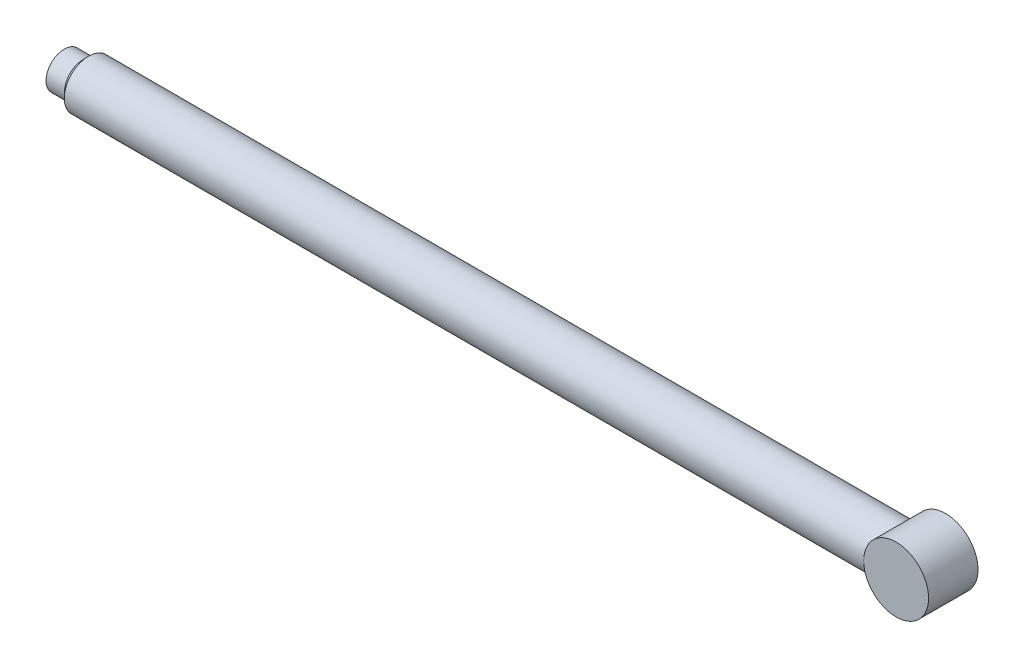
from build123d import *

# Parameters (mm, degrees)
SKETCH2_R                 = 150
SKETCH2_R_2               = 62.5
BOSS_EXTRUDE1_DEPTH       = 5000
SKETCH3_R                 = 112.5
SKETCH3_R_2               = 92.5
BOSS_EXTRUDE2_DEPTH       = 150
BOSS_EXTRUDE9_START       = -150
SKETCH4_R                 = 200
SKETCH4_R_2               = 150
BOSS_EXTRUDE9_DEPTH       = 300
SKETCH5_R                 = 150
CUT_EXTRUDE1_DEPTH        = 175
SKETCH6_R                 = 50
CUT_EXTRUDE2_DEPTH        = 5024
BOSS_EXTRUDE10_DEPTH      = 5
BOSS_EXTRUDE10_DEPTH_BACK = 5
SKETCH9_R                 = 200
SKETCH10_R                = 150
CUT_EXTRUDE3_DEPTH        = 202


with BuildPart() as part:
    # Sketch2 → Boss-Extrude1 (new body)
    with BuildSketch(Plane(origin=(0, 0, 0), x_dir=(0, 0, -1), z_dir=(1, 0, 0))):
        Circle(SKETCH2_R)
        Circle(SKETCH2_R_2, mode=Mode.SUBTRACT)
    extrude(amount=BOSS_EXTRUDE1_DEPTH)

    # Sketch3 → Boss-Extrude2 (add)
    with BuildSketch(Plane.ZY):
        with Locations(Location((0, 0, 0), (0, 0, 180))):
            Circle(SKETCH3_R)
        Circle(SKETCH3_R_2, mode=Mode.SUBTRACT)
    extrude(amount=BOSS_EXTRUDE2_DEPTH)

    # Sketch5 → Cut-Extrude1 (cut)
    with BuildSketch(Plane.XY.offset(150)):
        with Locations((5132.829656673, 0)):
            Circle(SKETCH5_R)
    extrude(amount=-CUT_EXTRUDE1_DEPTH, mode=Mode.SUBTRACT)

    # Sketch7 → Revolve1 (revolve)
    with BuildSketch(Plane.XY, mode=Mode.PRIVATE) as revolve1_sk:
        Polygon((0, 112.5), (0, 150), (-35.510152968, 112.5), align=None)
    revolve(revolve1_sk.sketch.rotate(Axis((-224.79445864, 0, 0), (1, 0, 0)), 270), axis=Axis((-224.79445864, 0, 0), (1, 0, 0)))



with BuildPart() as body_2:
    # Sketch4 → Boss-Extrude9 (new body)
    with BuildSketch(Plane.XY.offset(BOSS_EXTRUDE9_START)):
        with Locations((5132.829656673, 0)):
            Circle(SKETCH4_R)
        with Locations((5132.829656673, 0)):
            Circle(SKETCH4_R_2, mode=Mode.SUBTRACT)
    extrude(amount=BOSS_EXTRUDE9_DEPTH)

    # Sketch6 → Cut-Extrude2 (cut)
    with BuildSketch(Plane.ZY):
        Circle(SKETCH6_R)
    extrude(amount=-CUT_EXTRUDE2_DEPTH, mode=Mode.SUBTRACT)


with BuildPart() as part_1:
    add(part.part)

    add(body_2.part)  # Boss-Extrude10 merges body 2
    # Sketch9 → Boss-Extrude10 (add, two sides: drawn at the far end of the back side and taken through both)
    with BuildSketch(Plane.XY.offset(150).offset(-BOSS_EXTRUDE10_DEPTH_BACK)):
        with Locations(Location((5132.829656673, 0, 0), (0, 0, 180))):
            Circle(SKETCH9_R)
    extrude(amount=BOSS_EXTRUDE10_DEPTH + BOSS_EXTRUDE10_DEPTH_BACK)

    # Sketch10 → Cut-Extrude3 (cut)
    with BuildSketch(Plane(origin=(0, 0, -150), x_dir=(-1, 0, 0), z_dir=(0, 0, -1))):
        with Locations(Location((-5132.829656673, 0, 0), (0, 0, 180))):
            Circle(SKETCH10_R)
    extrude(amount=-CUT_EXTRUDE3_DEPTH, mode=Mode.SUBTRACT)


solid = part_1.part
